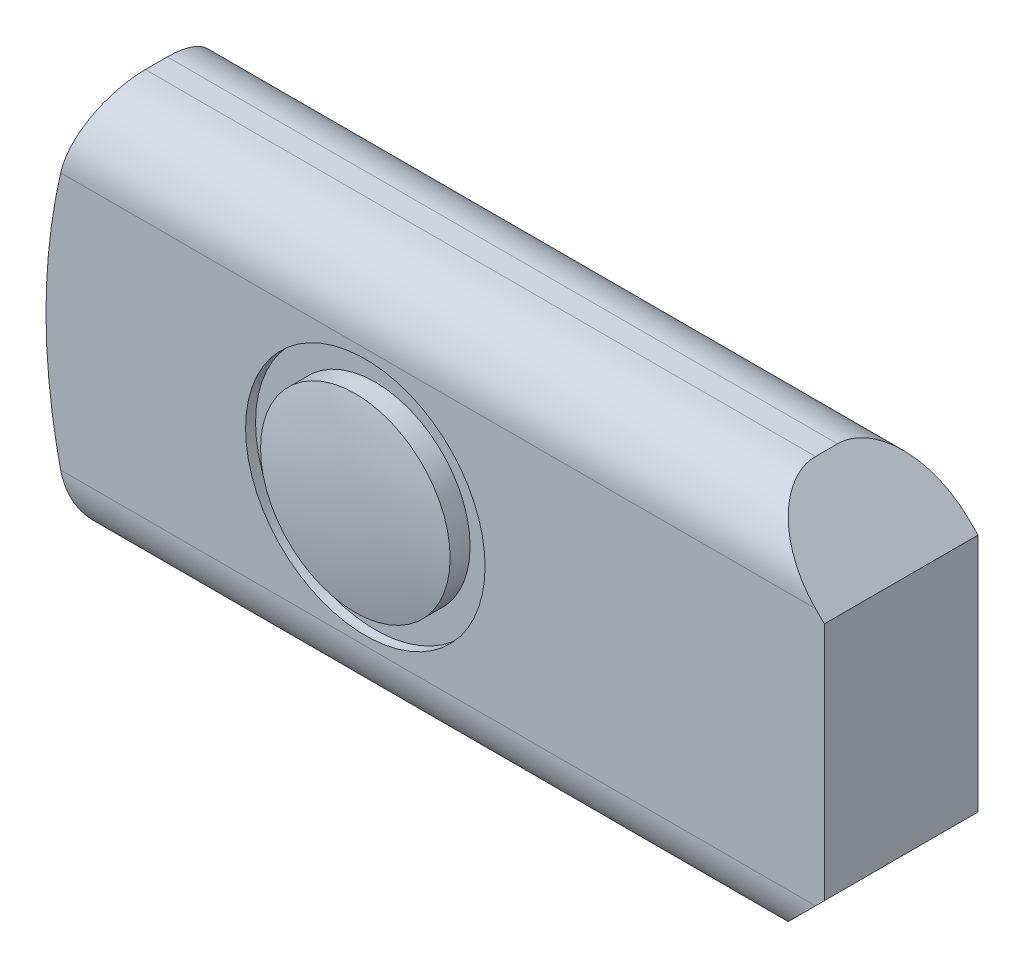
from build123d import *
from build123d.topology import SkipClean

# Parameters (mm, degrees)
BOSS_EXTRUDE1_DEPTH      = 7.7
FILLET1_R                = 3.3
CUT_EXTRUDE1_DEPTH       = 14.5
BOSS_EXTRUDE2_DEPTH      = 0.5
BOSS_EXTRUDE2_DEPTH_BACK = 8.2
SKETCH3_R                = 4.75
DOME1_FACE_RADIUS        = 4.75
DOME1_HEIGHT             = 0.5
DOME2_FACE_RADIUS        = 4.75
DOME2_HEIGHT             = 0.5
SKETCH4_R                = 6
SKETCH4_R_2              = 4.75
CUT_EXTRUDE2_DEPTH       = 0.5
CUT_EXTRUDE3_START       = -0.5
SKETCH5_R                = 6
SKETCH5_R_2              = 4.75
CUT_EXTRUDE3_DEPTH       = 0.5


with BuildPart() as part:
    # Sketch1 → Boss-Extrude1 (new body)
    with BuildSketch(Plane.XY):
        with BuildLine():
            Line((1.678605479, 0), (39, 0))
            Line((39, 0), (39, 19.5))
            Line((39, 19.5), (1.678605479, 19.5))
            add(Edge.make_bspline(
                [(1.678605479, 19.5), (-1.678605479, 9.75), (1.678605479, 0)],
                knots=[0, 0, 0, 1, 1, 1], degree=2))
        make_face()
    extrude(amount=BOSS_EXTRUDE1_DEPTH)

    # Fillet1
    fillet1_edges = [part.edges().sort_by_distance(p)[0] for p in [
        (20.339302739, 0, 7.7),
        (20.339302739, 0, 0),
        (20.339302739, 19.5, 0),
        (20.339302739, 19.5, 7.7),
    ]]
    fillet(fillet1_edges, radius=FILLET1_R)

    # Sketch2 → Cut-Extrude1 (cut)
    with BuildSketch(Plane.XY):
        Polygon((35.25816866, 19.5), (39, 15.75816866), (39, 3.74183134), (35.25816866, 0), (41.546520984, 0), (41.546520984, 19.5), align=None)
    extrude(amount=CUT_EXTRUDE1_DEPTH, mode=Mode.SUBTRACT)

    # Sketch3 → Boss-Extrude2 (add, two sides: drawn at the far end of the back side and taken through both)
    with BuildSketch(Plane.XY.offset(7.7).offset(-BOSS_EXTRUDE2_DEPTH_BACK)):
        with Locations((16, 9.75)):
            Circle(SKETCH3_R)
    extrude(amount=BOSS_EXTRUDE2_DEPTH + BOSS_EXTRUDE2_DEPTH_BACK)

    # Dome1: a dome of height H over a round flat face of radius A is a cap of a sphere of radius (A * A + H * H) / (2 * H)
    dome1_r = (DOME1_FACE_RADIUS * DOME1_FACE_RADIUS + DOME1_HEIGHT * DOME1_HEIGHT) / (2 * DOME1_HEIGHT)
    dome1_base = Plane((16, 9.75, 8.2), z_dir=(0, 0, 1))
    with Locations(dome1_base.offset(DOME1_HEIGHT - dome1_r)):
        dome1_ball = Sphere(dome1_r, mode=Mode.PRIVATE)
    add(split(dome1_ball, bisect_by=dome1_base, keep=Keep.TOP, mode=Mode.PRIVATE))

    # Dome2: a dome of height H over a round flat face of radius A is a cap of a sphere of radius (A * A + H * H) / (2 * H)
    dome2_r = (DOME2_FACE_RADIUS * DOME2_FACE_RADIUS + DOME2_HEIGHT * DOME2_HEIGHT) / (2 * DOME2_HEIGHT)
    dome2_base = Plane((16, 9.75, -0.5), z_dir=(0, 0, -1))
    with Locations(dome2_base.offset(DOME2_HEIGHT - dome2_r)):
        dome2_ball = Sphere(dome2_r, mode=Mode.PRIVATE)
    add(split(dome2_ball, bisect_by=dome2_base, keep=Keep.TOP, mode=Mode.PRIVATE))

    # Sketch4 → Cut-Extrude2 (cut)
    with BuildSketch(Plane(origin=(0, 0, 0), x_dir=(-1, 0, 0), z_dir=(0, 0, -1))):
        with Locations((-16, 9.75)):
            Circle(SKETCH4_R)
        with Locations(Location((-16, 9.75, 0), (0, 0, 180))):
            Circle(SKETCH4_R_2, mode=Mode.SUBTRACT)
    extrude(amount=-CUT_EXTRUDE2_DEPTH, mode=Mode.SUBTRACT)

    # Sketch5 → Cut-Extrude3 (cut)
    with SkipClean():  # the faces are left unmerged after this step: merging them gives an invalid solid
        with BuildSketch(Plane.XY.offset(7.7).offset(CUT_EXTRUDE3_START)):
            with Locations(Location((16, 9.75, 0), (0, 0, 180))):
                Circle(SKETCH5_R)
            with Locations((16, 9.75)):
                Circle(SKETCH5_R_2, mode=Mode.SUBTRACT)
        extrude(amount=CUT_EXTRUDE3_DEPTH, mode=Mode.SUBTRACT)


solid = part.part
